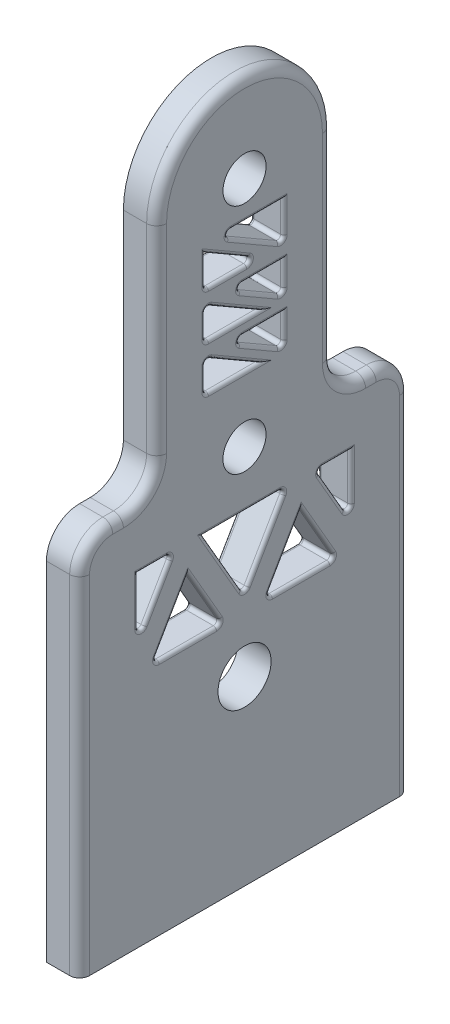
from build123d import *

# Parameters (mm, degrees)
BOSS_EXTRUDE1_DEPTH = 10
SKETCH10_R          = 6.5
CUT_EXTRUDE1_DEPTH  = 10
FILLET1_R           = 10
FILLET2_R           = 10
FILLET4_R           = 3
CUT_EXTRUDE2_DEPTH  = 10
FILLET5_R           = 1
CUT_EXTRUDE5_DEPTH  = 10
FILLET6_R           = 1
SKETCH2_15_R        = 8
CUT_EXTRUDE6_DEPTH  = 10


with BuildPart() as part:
    # Sketch2 → Boss-Extrude1 (new body)
    with BuildSketch(Plane(origin=(0, 0, 0), x_dir=(0, 0, -1), z_dir=(1, 0, 0))):
        with BuildLine():
            Line((-49.7, 130), (-49.7, -54.7))
            Line((-49.7, -54.7), (49.7, -54.7))
            Line((49.7, -54.7), (49.7, 130))
            ThreePointArc((49.7, 130), (0, 179.7), (-49.7, 130))
        make_face()
    extrude(amount=BOSS_EXTRUDE1_DEPTH)

    # Sketch10 → Cut-Extrude1 (cut)
    with BuildSketch(Plane.ZY):
        with BuildLine():
            ThreePointArc((-26.49999955, 129.995115464), (-0.002442268, 156.499999887), (26.5, 130))
            Line((26.5, 130), (26.5, 60))
            Line((26.5, 60), (49.7, 60))
            Line((49.7, 60), (49.7, 130))
            ThreePointArc((49.7, 130), (0, 179.7), (-49.7, 130))
            Line((-49.7, 130), (-51.663531729, 100))
            Line((-51.663531729, 100), (-51.663531729, 59.983970667))
            Line((-51.663531729, 59.983970667), (-49.687096609, 59.990840381))
            Line((-49.687096609, 59.990840381), (-26.487097003, 59.995116653))
            Line((-26.487097003, 59.995116653), (-26.49999955, 129.995115464))
        make_face()
        with Locations((0.006451274, 60)):
            Circle(SKETCH10_R)
        with Locations((0, 130)):
            Circle(SKETCH10_R)
    extrude(amount=-CUT_EXTRUDE1_DEPTH, mode=Mode.SUBTRACT)

    # Fillet1
    fillet1_edges = [part.edges().sort_by_distance(p)[0] for p in [
        (5, 60, 26.5),
        (5, 59.995116653, -26.487097003),
    ]]
    fillet(fillet1_edges, radius=FILLET1_R)

    # Fillet2
    fillet2_edges = [part.edges().sort_by_distance(p)[0] for p in [
        (5, 60, 49.7),
        (5, 59.990795531, -49.7),
    ]]
    fillet(fillet2_edges, radius=FILLET2_R)

    # Fillet4
    fillet4_edges = [part.edges().sort_by_distance(p)[0] for p in [
        (10, 100, 26.5),
        (10, 62.928932188, 29.428932188),
        (10, 60, 38.1),
        (10, 57.071067812, 46.771067812),
        (10, -2.35, 49.7),
        (10, -2.353659473, -49.7),
        (10, 57.063097158, -46.771719459),
        (10, 59.992977158, -38.094470027),
        (10, 62.923508925, -29.416569008),
        (10, 99.995115974, -26.494469887),
        (10, 156.499999887, -0.002442268),
    ]]
    fillet(fillet4_edges, radius=FILLET4_R)

    # Sketch11 → Cut-Extrude2 (cut)
    with BuildSketch(Plane(origin=(10, 0, 0), x_dir=(0, 0, -1), z_dir=(1, 0, 0))):
        Polygon((-21.692176243, 43.000001224), (-32.084481795, 43.000001224), (-32.084481795, 25), align=None)
        Polygon((12.454571936, 43.000001224), (-12.454571936, 43.000001224), (0, 21.428049844), align=None)
        Polygon((-17.07337409, 35.000001224), (-27.465679642, 17), (-6.681068537, 17), align=None)
        Polygon((32.084481795, 43.000001224), (21.692176243, 43.000001224), (32.084481795, 25), align=None)
        Polygon((17.07337409, 35.000001224), (6.681068537, 17), (27.465679642, 17), align=None)
    extrude(amount=-CUT_EXTRUDE2_DEPTH, mode=Mode.SUBTRACT)

    # Fillet5
    fillet5_edges = [part.edges().sort_by_distance(p)[0] for p in [
        (0, 34.000000612, 32.084481795),
        (10, 34.000000612, 32.084481795),
        (0, 43.000001224, 26.888329019),
        (10, 43.000001224, 26.888329019),
        (0, 26.000000612, 22.269526866),
        (10, 26.000000612, 22.269526866),
        (0, 26.000000612, 11.877221314),
        (10, 26.000000612, 11.877221314),
        (0, 32.214025534, 6.227285968),
        (10, 32.214025534, 6.227285968),
        (0, 43.000001224, 0),
        (10, 43.000001224, 0),
        (0, 26.000000612, -11.877221314),
        (10, 26.000000612, -11.877221314),
        (0, 26.000000612, -22.269526866),
        (10, 26.000000612, -22.269526866),
        (0, 43.000001224, -26.888329019),
        (10, 43.000001224, -26.888329019),
        (0, 34.000000612, -32.084481795),
        (10, 34.000000612, -32.084481795),
        (5, 25, 32.084481795),
        (0, 34.000000612, 26.888329019),
        (5, 43.000001224, 21.692176243),
        (10, 34.000000612, 26.888329019),
        (5, 17, 27.465679642),
        (0, 17, 17.07337409),
        (5, 17, 6.681068537),
        (10, 17, 17.07337409),
        (5, 21.428049844, 0),
        (0, 32.214025534, -6.227285968),
        (5, 43.000001224, -12.454571936),
        (10, 32.214025534, -6.227285968),
        (5, 17, -6.681068537),
        (0, 17, -17.07337409),
        (5, 17, -27.465679642),
        (10, 17, -17.07337409),
        (5, 43.000001224, -21.692176243),
        (0, 34.000000612, -26.888329019),
        (5, 25, -32.084481795),
        (10, 34.000000612, -26.888329019),
    ]]
    fillet(fillet5_edges, radius=FILLET5_R)

    # Sketch13 → Cut-Extrude5 (cut)
    with BuildSketch(Plane(origin=(10, 0, 0), x_dir=(0, 0, -1), z_dir=(1, 0, 0))):
        Polygon((11.876221569, 118.683117188), (-7.876221569, 118.683117188), (11.876221569, 107.279038825), align=None)
        Polygon((4.412119954, 106.969637748), (-11.876221569, 116.373716111), (-11.876221569, 106.969637748), align=None)
        Polygon((11.876221569, 93.565559385), (11.876221569, 102.969637748), (-4.412119954, 102.969637748), align=None)
        Polygon((4.412119954, 93.256158309), (-11.876221569, 102.660236672), (-11.876221569, 93.256158309), align=None)
        Polygon((11.876221569, 79.852079945), (11.876221569, 89.256158309), (-4.412119954, 89.256158309), align=None)
        Polygon((4.412119954, 79.542678869), (-11.876221569, 88.946757232), (-11.876221569, 79.542678869), align=None)
    extrude(amount=-CUT_EXTRUDE5_DEPTH, mode=Mode.SUBTRACT)

    # Fillet6
    fillet6_edges = [part.edges().sort_by_distance(p)[0] for p in [
        (0, 118.683117188, -2),
        (10, 118.683117188, -2),
        (0, 112.981078007, -11.876221569),
        (10, 112.981078007, -11.876221569),
        (10, 97.95819749, 3.732050808),
        (0, 93.256158309, 3.732050808),
        (10, 93.256158309, 3.732050808),
        (0, 89.256158309, -3.732050808),
        (10, 89.256158309, -3.732050808),
        (0, 84.554119127, -11.876221569),
        (10, 84.554119127, -11.876221569),
        (0, 84.24471805, 3.732050808),
        (10, 84.24471805, 3.732050808),
        (0, 79.542678869, 3.732050808),
        (10, 79.542678869, 3.732050808),
        (5, 118.683117188, 7.876221569),
        (0, 112.981078007, -2),
        (5, 107.279038825, -11.876221569),
        (10, 112.981078007, -2),
        (5, 102.660236672, 11.876221569),
        (0, 97.95819749, 11.876221569),
        (5, 93.256158309, 11.876221569),
        (10, 97.95819749, 11.876221569),
        (5, 89.256158309, 4.412119954),
        (0, 84.554119127, -3.732050808),
        (5, 79.852079945, -11.876221569),
        (10, 84.554119127, -3.732050808),
        (5, 88.946757232, 11.876221569),
        (0, 84.24471805, 11.876221569),
        (5, 79.542678869, 11.876221569),
        (10, 84.24471805, 11.876221569),
        (5, 106.969637748, 11.876221569),
        (0, 97.95819749, 3.732050808),
        (0, 102.969637748, -3.732050808),
        (10, 102.969637748, -3.732050808),
        (0, 98.267598567, -11.876221569),
        (10, 98.267598567, -11.876221569),
        (0, 111.67167693, 11.876221569),
        (10, 111.67167693, 11.876221569),
        (0, 111.67167693, 3.732050808),
        (10, 111.67167693, 3.732050808),
        (5, 102.969637748, 4.412119954),
        (0, 98.267598567, -3.732050808),
        (5, 93.565559385, -11.876221569),
        (10, 98.267598567, -3.732050808),
        (0, 106.969637748, 3.732050808),
        (5, 106.969637748, -4.412119954),
        (10, 106.969637748, 3.732050808),
    ]]
    fillet(fillet6_edges, radius=FILLET6_R)

    # Sketch2<15> → Cut-Extrude6 (cut)
    with BuildSketch(Plane(origin=(0, 0, 0), x_dir=(0, 0, -1), z_dir=(1, 0, 0))):
        Circle(SKETCH2_15_R)
    extrude(amount=CUT_EXTRUDE6_DEPTH, mode=Mode.SUBTRACT)


solid = part.part
